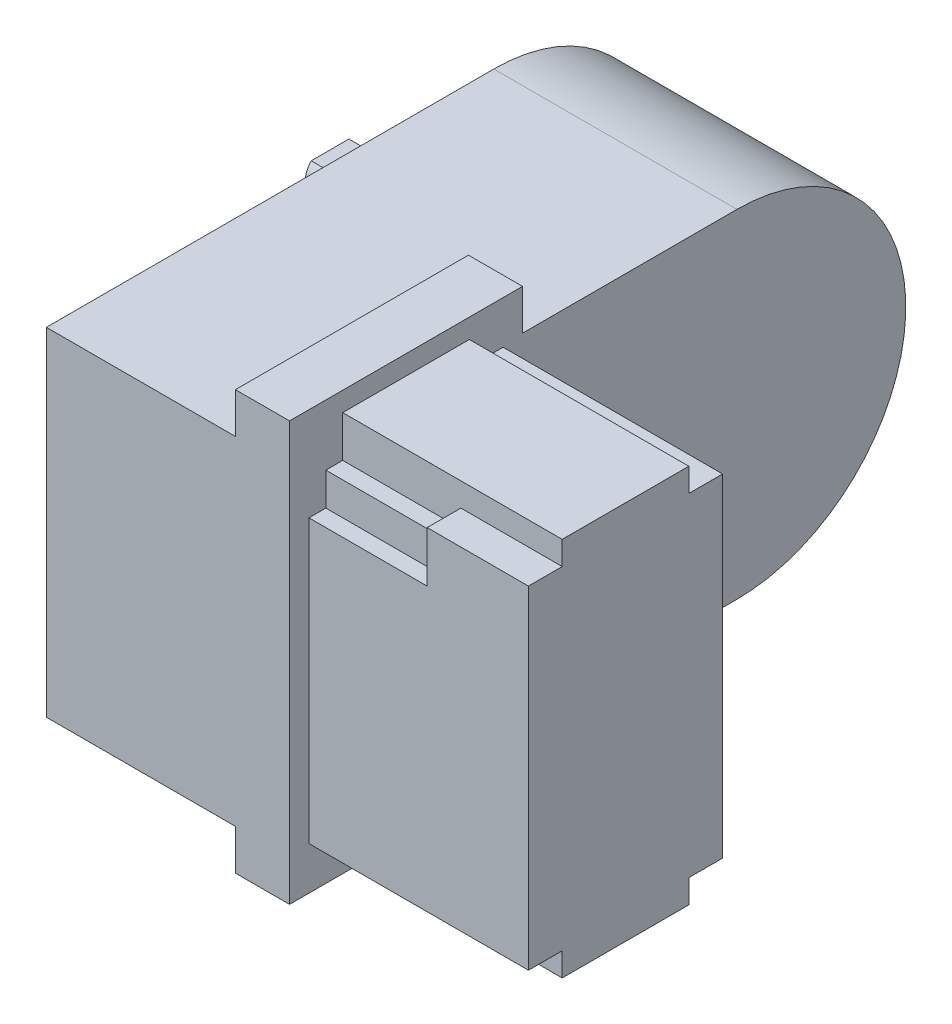
from build123d import *

# Parameters (mm, degrees)
SKETCH1_R           = 10
SKETCH1_W           = 31.5
SKETCH1_H           = 20
SKETCH1_W_2         = 3.204542896
SKETCH1_H_2         = 24.8
BOSS_EXTRUDE1_DEPTH = 6.9
BOSS_EXTRUDE2_DEPTH = 5.75
BOSS_EXTRUDE3_DEPTH = 9.7
SKETCH3_W           = 13
SKETCH3_H           = 1.999999936
SKETCH3_H_2         = 2.000000064
CUT_EXTRUDE1_DEPTH  = 1.397
SKETCH4_W           = 7.0000114
SKETCH4_H           = 1.016
CUT_EXTRUDE2_DEPTH  = 2.000000064
SKETCH6_W           = 7
SKETCH6_H           = 1.947
CUT_EXTRUDE4_DEPTH  = 1
SKETCH4_3_W         = 7.0000114
SKETCH4_3_H         = 2.032
CUT_EXTRUDE3_DEPTH  = 0.95
SKETCH6_3_W         = 7
SKETCH6_3_H         = 1.053
CUT_EXTRUDE5_DEPTH  = 1.999999936
BOSS_EXTRUDE4_START = -3.75
BOSS_EXTRUDE4_DEPTH = 7.5
SKETCH9_W           = 36.585233059
SKETCH9_H           = 32.734155895
CUT_EXTRUDE6_DEPTH  = 53.512569924
SKETCH10_R          = 10
BOSS_EXTRUDE5_DEPTH = 14.400000064
BOSS_EXTRUDE6_DEPTH = 9.7


with BuildPart() as part:
    # Sketch1 → Boss-Extrude1 (new, symmetric)
    with BuildSketch(Plane.XY):
        Circle(SKETCH1_R)
        with Locations((15.75, 0)):
            Rectangle(SKETCH1_W, SKETCH1_H)
        with Locations((29.897728552, 0)):
            Rectangle(SKETCH1_W_2, SKETCH1_H_2)
    extrude(amount=BOSS_EXTRUDE1_DEPTH, both=True)

    # Sketch2 → Boss-Extrude3 (add)
    with BuildSketch(Plane.XY.offset(6.9)):
        with BuildLine():
            Line((1.118033989, 1), (-1.118033989, 1))
            ThreePointArc((-1.118033989, 1), (-0.535233135, -1.401258538), (1.5, 0))
            ThreePointArc((1.5, 0), (1.401258538, 0.535233135), (1.118033989, 1))
        make_face()
    extrude(amount=BOSS_EXTRUDE3_DEPTH)

    # Sketch8 → Boss-Extrude4 (add)
    with BuildSketch(Plane.XY.offset(BOSS_EXTRUDE4_START)):
        Polygon((26.795457104, 10.4), (28.295457104, 10.4), (28.295457104, 11.9), align=None)
        Polygon((26.795457104, -10.4), (28.295457104, -10.4), (28.295457104, -11.9), align=None)
    extrude(amount=BOSS_EXTRUDE4_DEPTH)

    # Sketch9 → Cut-Extrude6 (cut, through all)
    with BuildSketch(Plane(origin=(0, 10, 0), x_dir=(1, 0, 0), z_dir=(0, 1, 0))):
        with Locations((-1.192616594, -3.580870026)):
            Rectangle(SKETCH9_W, SKETCH9_H)
    extrude(amount=-CUT_EXTRUDE6_DEPTH, mode=Mode.SUBTRACT)

    # Sketch10 → Boss-Extrude5 (add)
    with BuildSketch(Plane.ZY.offset(-17.099999936)):
        with Locations((-19.6, 0)):
            Circle(SKETCH10_R)
        with BuildLine():
            Line((-6.9, 10), (-19.6, 10))
            ThreePointArc((-19.6, 10), (-12.528932188, 7.071067812), (-9.6, 0))
            ThreePointArc((-9.6, 0), (-12.528932188, -7.071067812), (-19.6, -10))
            Line((-19.6, -10), (-6.9, -10))
            Line((-6.9, -10), (-6.9, 10))
        make_face()
    extrude(amount=-BOSS_EXTRUDE5_DEPTH)

    # Sketch11 → Boss-Extrude6 (add)
    with BuildSketch(Plane.ZY.offset(-17.099999936)):
        with BuildLine():
            Line((-18.481966011, 1), (-20.718033989, 1))
            ThreePointArc((-20.718033989, 1), (-20.135233135, -1.401258538), (-18.1, 0))
            ThreePointArc((-18.1, 0), (-18.198741462, 0.535233135), (-18.481966011, 1))
        make_face()
    extrude(amount=BOSS_EXTRUDE6_DEPTH)


with BuildPart() as body_2:
    # Sketch1<3> → Boss-Extrude2 (new, symmetric)
    with BuildSketch(Plane.XY):
        Polygon((31.5, 11.25), (31.5, 10), (31.5, 0), (44.5, 0), (44.5, 11.25), align=None)
        Polygon((31.5, 0), (31.5, -10), (31.5, -11.25), (44.5, -11.25), (44.5, 0), align=None)
    extrude(amount=BOSS_EXTRUDE2_DEPTH, both=True)

    # Sketch3 → Cut-Extrude1 (cut)
    with BuildSketch(Plane.XZ.offset(11.25)):
        with Locations((38, 4.750000032)):
            Rectangle(SKETCH3_W, SKETCH3_H)
        with Locations((38, -4.749999968)):
            Rectangle(SKETCH3_W, SKETCH3_H_2)
    cut_extrude1 = extrude(amount=-CUT_EXTRUDE1_DEPTH, mode=Mode.SUBTRACT)

    # Mirror1: Cut-Extrude1 across plane
    add(cut_extrude1.mirror(Plane.ZX), mode=Mode.SUBTRACT)

    # Sketch4 → Cut-Extrude2 (cut)
    with BuildSketch(Plane(origin=(0, 0, -5.75), x_dir=(-1, 0, 0), z_dir=(0, 0, -1))):
        with Locations((-35.0000057, -9.345)):
            Rectangle(SKETCH4_W, SKETCH4_H)
    extrude(amount=-CUT_EXTRUDE2_DEPTH, mode=Mode.SUBTRACT)

    # Sketch6 → Cut-Extrude4 (cut)
    with BuildSketch(Plane.XY.offset(5.75)):
        with Locations((35, 7.8265)):
            Rectangle(SKETCH6_W, SKETCH6_H)
    extrude(amount=-CUT_EXTRUDE4_DEPTH, mode=Mode.SUBTRACT)

    # Sketch4<3> → Cut-Extrude3 (cut)
    with BuildSketch(Plane(origin=(0, 0, -5.75), x_dir=(-1, 0, 0), z_dir=(0, 0, -1))):
        with Locations((-35.0000057, -7.821)):
            Rectangle(SKETCH4_3_W, SKETCH4_3_H)
    extrude(amount=-CUT_EXTRUDE3_DEPTH, mode=Mode.SUBTRACT)

    # Sketch6<3> → Cut-Extrude5 (cut)
    with BuildSketch(Plane.XY.offset(5.75)):
        with Locations((35, 9.3265)):
            Rectangle(SKETCH6_3_W, SKETCH6_3_H)
    extrude(amount=-CUT_EXTRUDE5_DEPTH, mode=Mode.SUBTRACT)


solid = Compound([part.part, body_2.part])
